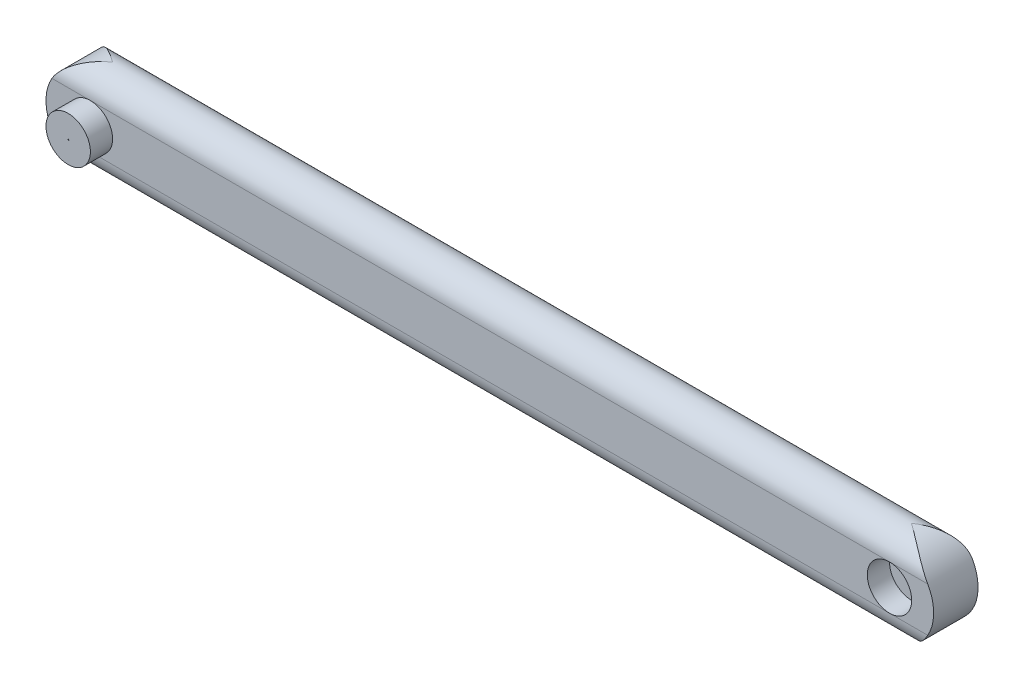
from build123d import *

# Parameters (mm, degrees)
BOSS_EXTRUDE1_DEPTH = 2000
CUT_EXTRUDE1_DEPTH  = 100
SKETCH3_R           = 50
CUT_EXTRUDE2_DEPTH  = 50
SKETCH4_R           = 50
BOSS_EXTRUDE2_DEPTH = 50
SKETCH5_W           = 1.860422616
SKETCH5_H           = 2.197438595
CUT_EXTRUDE3_DEPTH  = 1


with BuildPart() as part:
    # Sketch1 → Boss-Extrude1 (new body)
    with BuildSketch(Plane(origin=(0, 0, 0), x_dir=(0, 0, -1), z_dir=(1, 0, 0))):
        with BuildLine():
            Line((-50, 50), (-50, -50))
            ThreePointArc((-50, -50), (0, -100), (50, -50))
            Line((50, -50), (50, 50))
            ThreePointArc((50, 50), (0, 100), (-50, 50))
        make_face()
    extrude(amount=-BOSS_EXTRUDE1_DEPTH)

    # Sketch2 → Cut-Extrude1 (cut)
    with BuildSketch(Plane.XY.offset(50)):
        with BuildLine():
            Line((-1899.5, 100), (-2000, 100))
            Line((-2000, 100), (-2000, -100))
            Line((-2000, -100), (-1899.5, -100))
            ThreePointArc((-1899.5, -100), (-1999.5, 0), (-1899.5, 100))
        make_face()
        with BuildLine():
            Line((-100.5, 100), (0, 100))
            Line((0, 100), (0, -100))
            Line((0, -100), (-100.5, -100))
            ThreePointArc((-100.5, -100), (-0.5, 0), (-100.5, 100))
        make_face()
    extrude(amount=-CUT_EXTRUDE1_DEPTH, mode=Mode.SUBTRACT)

    # Sketch3 → Cut-Extrude2 (cut)
    with BuildSketch(Plane.XY.offset(50)):
        with Locations((-100, 0)):
            Circle(SKETCH3_R)
    extrude(amount=-CUT_EXTRUDE2_DEPTH, mode=Mode.SUBTRACT)

    # Sketch4 → Boss-Extrude2 (add)
    with BuildSketch(Plane.XY.offset(50)):
        with Locations(Location((-1899.5, 0, 0), (0, 0, 270))):
            Circle(SKETCH4_R)
    extrude(amount=BOSS_EXTRUDE2_DEPTH)

    # Sketch5 → Cut-Extrude3 (cut)
    with BuildSketch(Plane.XY.offset(100)):
        with Locations((-1898.569788692, -1.098719297)):
            Rectangle(SKETCH5_W, SKETCH5_H)
    extrude(amount=-CUT_EXTRUDE3_DEPTH, mode=Mode.SUBTRACT)


solid = part.part
